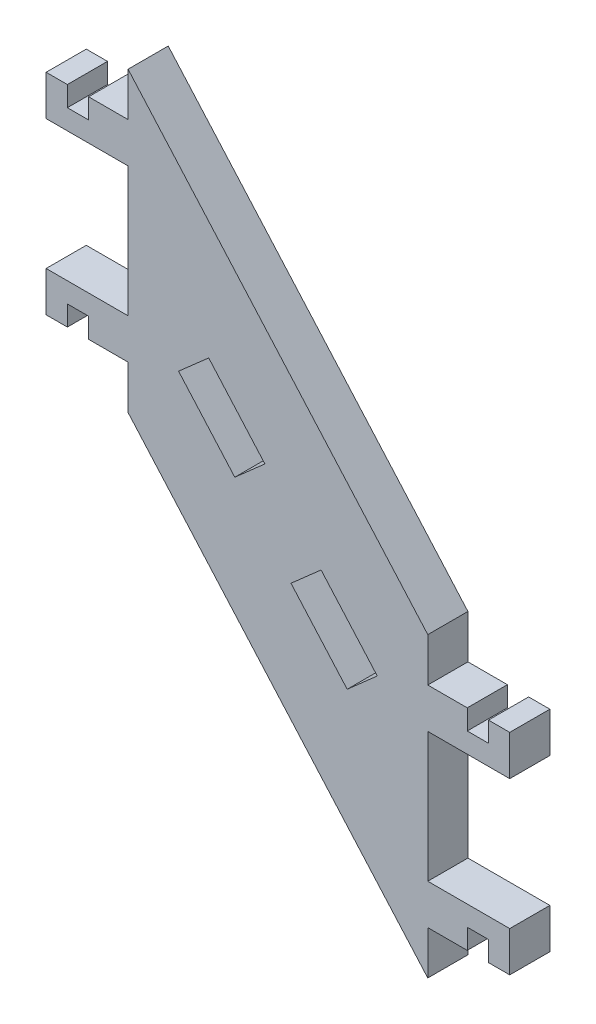
from build123d import *

# Parameters (mm, degrees)
PROFILE_DEPTH      = 6
CUT_EXTRUDE1_DEPTH = 93.862011134


with BuildPart() as part:
    # Sketch1 → Profile (new body)
    with BuildSketch(Plane.XY):
        Polygon((-44.8, 73.025), (-44.8, 66.5), (-50.699999884, 66.5), (-50.699999884, 63.5), (-53.874999884, 63.5), (-53.874999884, 66.5), (-57.049999884, 66.5), (-57.049999884, 60.5), (-44.8, 60.5), (-44.8, 41.1), (-57.049999884, 41.1), (-57.049999884, 35.1), (-53.874999884, 35.1), (-53.874999884, 38.1), (-50.699999884, 38.1), (-50.699999884, 35.1), (-44.8, 35.1), (-44.8, 28.575), (0, -22.225), (0, -15.7), (5.899999884, -15.7), (5.899999884, -12.7), (9.074999884, -12.7), (9.074999884, -15.7), (12.249999884, -15.7), (12.249999884, -9.7), (0, -9.7), (0, 9.7), (12.249999884, 9.7), (12.249999884, 15.7), (9.074999884, 15.7), (9.074999884, 12.7), (5.899999884, 12.7), (5.899999884, 15.7), (0, 15.7), (0, 22.225), align=None)
    extrude(amount=PROFILE_DEPTH)

    # Sketch2 → Cut-Extrude1 (cut, through all)
    with BuildSketch(Plane.XY.offset(6)):
        Polygon((-32.750140375, 41.671972659), (-37.250201408, 37.703414898), (-28.85008748, 28.178285712), (-24.350026447, 32.146843473), align=None)
        Polygon((-15.94991252, 22.621714288), (-7.549798592, 13.096585102), (-12.049859625, 9.128027341), (-20.449973553, 18.653156527), align=None)
    extrude(amount=-CUT_EXTRUDE1_DEPTH, mode=Mode.SUBTRACT)


solid = part.part
